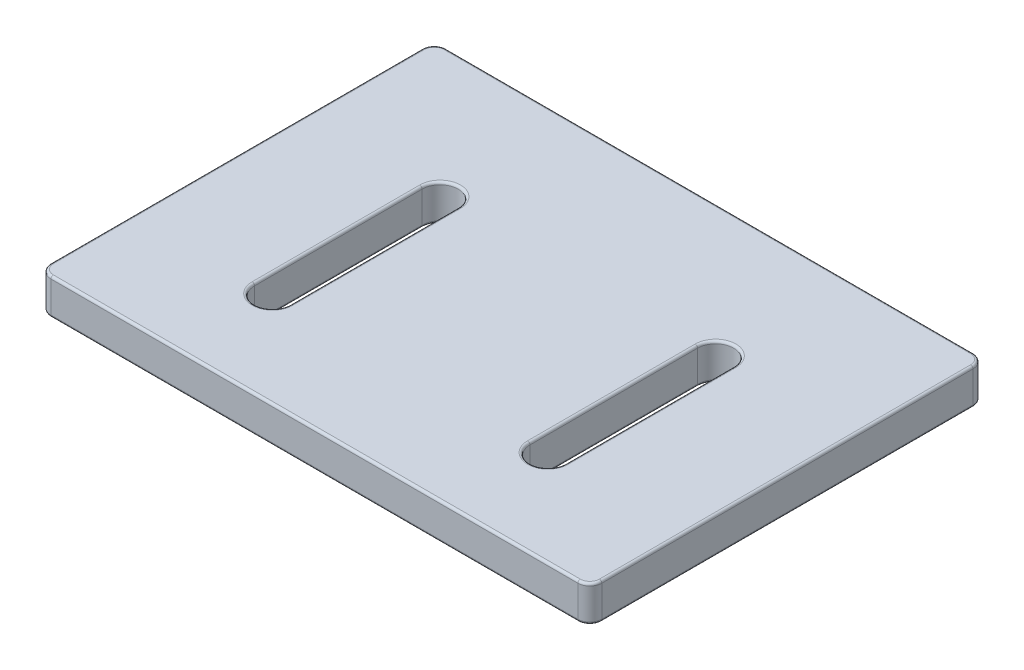
from build123d import *

# Parameters (mm, degrees)
BOSS_EXTRUDE1_DEPTH = 3
FILLET1_R           = 0.2


with BuildPart() as part:
    # Sketch1 → Boss-Extrude1 (new body)
    with BuildSketch(Plane(origin=(0, 0, 0), x_dir=(1, 0, 0), z_dir=(0, 1, 0))):
        with BuildLine():
            Line((22, 0), (-22, 0))
            ThreePointArc((-22, 0), (-22.707106781, 0.292893219), (-23, 1))
            Line((-23, 1), (-23, 32))
            ThreePointArc((-23, 32), (-22.707106781, 32.707106781), (-22, 33))
            Line((-22, 33), (22, 33))
            ThreePointArc((22, 33), (22.707106781, 32.707106781), (23, 32))
            Line((23, 32), (23, 1))
            ThreePointArc((23, 1), (22.707106781, 0.292893219), (22, 0))
        make_face()
        with BuildLine():
            Line((-10, 22), (-10, 8))
            ThreePointArc((-10, 8), (-11.5, 6.5), (-13, 8))
            Line((-13, 8), (-13, 22))
            ThreePointArc((-13, 22), (-11.5, 23.5), (-10, 22))
        make_face(mode=Mode.SUBTRACT)
        with BuildLine():
            Line((10, 22), (10, 8))
            ThreePointArc((10, 8), (11.5, 6.5), (13, 8))
            Line((13, 8), (13, 22))
            ThreePointArc((13, 22), (11.5, 23.5), (10, 22))
        make_face(mode=Mode.SUBTRACT)
    extrude(amount=BOSS_EXTRUDE1_DEPTH)

    # Fillet1
    fillet1_edges = [part.edges().sort_by_distance(p)[0] for p in [
        (22.707106781, 3, -0.292893219),
        (0, 0, 0),
        (-22.707106781, 0, -0.292893219),
        (23, 3, -16.5),
        (22.707106781, 3, -32.707106781),
        (0, 3, -33),
        (-22.707106781, 3, -32.707106781),
        (-11.5, 0, -23.5),
        (-13, 0, -15),
        (-11.5, 0, -6.5),
        (-10, 0, -15),
        (-23, 3, -16.5),
        (-11.5, 3, -23.5),
        (-13, 3, -15),
        (-11.5, 3, -6.5),
        (-10, 3, -15),
        (11.5, 0, -23.5),
        (10, 0, -15),
        (11.5, 0, -6.5),
        (13, 0, -15),
        (11.5, 3, -23.5),
        (10, 3, -15),
        (11.5, 3, -6.5),
        (13, 3, -15),
        (-22.707106781, 3, -0.292893219),
        (0, 3, 0),
        (-23, 0, -16.5),
        (-22.707106781, 0, -32.707106781),
        (0, 0, -33),
        (22.707106781, 0, -32.707106781),
        (23, 0, -16.5),
        (22.707106781, 0, -0.292893219),
    ]]
    fillet(fillet1_edges, radius=FILLET1_R)


solid = part.part
